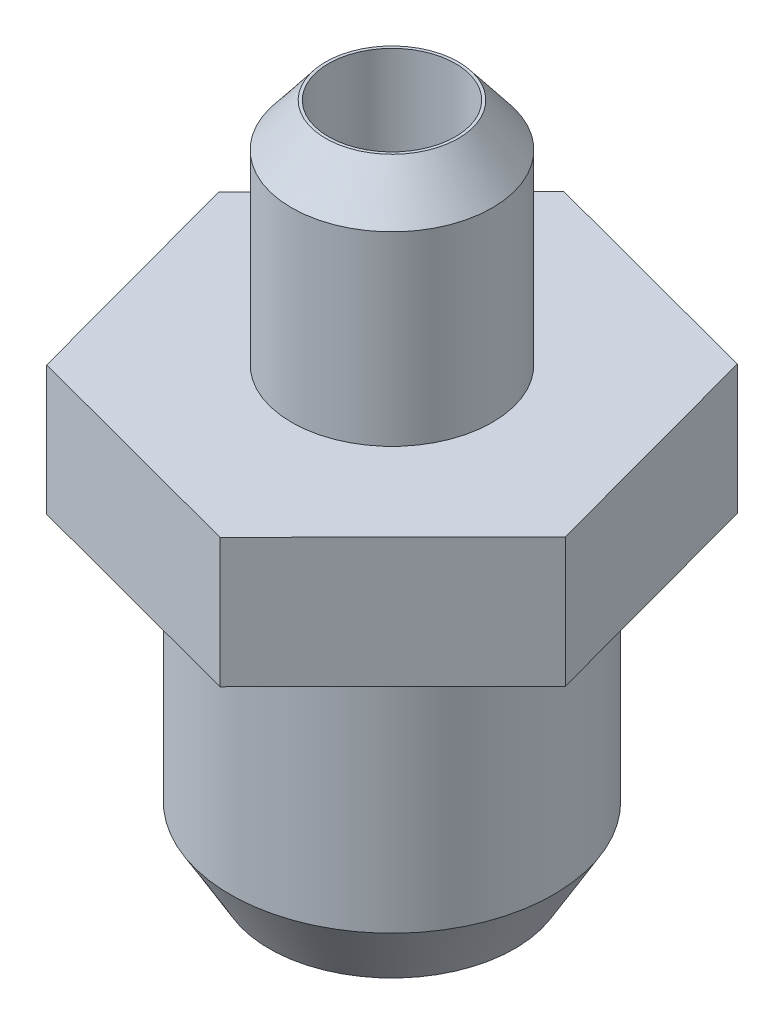
from build123d import *

# Parameters (mm, degrees)
BOSS_EXTRUDE1_DEPTH = 7.8
SKETCH4_R           = 3.825420683
CUT_EXTRUDE2_DEPTH  = 46.305179634


with BuildPart() as part:
    # Sketch1 → Revolve1 (revolve)
    with BuildSketch(Plane.XY, mode=Mode.PRIVATE) as revolve1_sk:
        Polygon((0, 0), (0, 40.6), (4, 40.6), (6.05, 38), (6.05, 26.8), (12.7, 26.8), (12.7, 19), (9.75, 19), (9.75, 4), (7.4, 0), align=None)
    revolve(revolve1_sk.sketch.rotate(Axis((0, 0, 0), (0, 1, 0)), 90), axis=Axis((0, 0, 0), (0, 1, 0)))

    # Sketch3 → Boss-Extrude1 (add)
    with BuildSketch(Plane(origin=(0, 26.8, 0), x_dir=(1, 0, 0), z_dir=(0, 1, 0))):
        Polygon((14.224650165, -3.777575457), (10.383801393, 10.430120675), (-3.840848772, 14.207696132), (-14.224650165, 3.777575457), (-10.383801393, -10.430120675), (3.840848772, -14.207696132), align=None)
    extrude(amount=-BOSS_EXTRUDE1_DEPTH)

    # Sketch4 → Cut-Extrude2 (cut, through all)
    with BuildSketch(Plane(origin=(0, 40.6, 0), x_dir=(1, 0, 0), z_dir=(0, 1, 0))):
        with Locations(Location((0, 0, 0), (0, 0, 270))):
            Circle(SKETCH4_R)
    extrude(amount=-CUT_EXTRUDE2_DEPTH, mode=Mode.SUBTRACT)


solid = part.part
